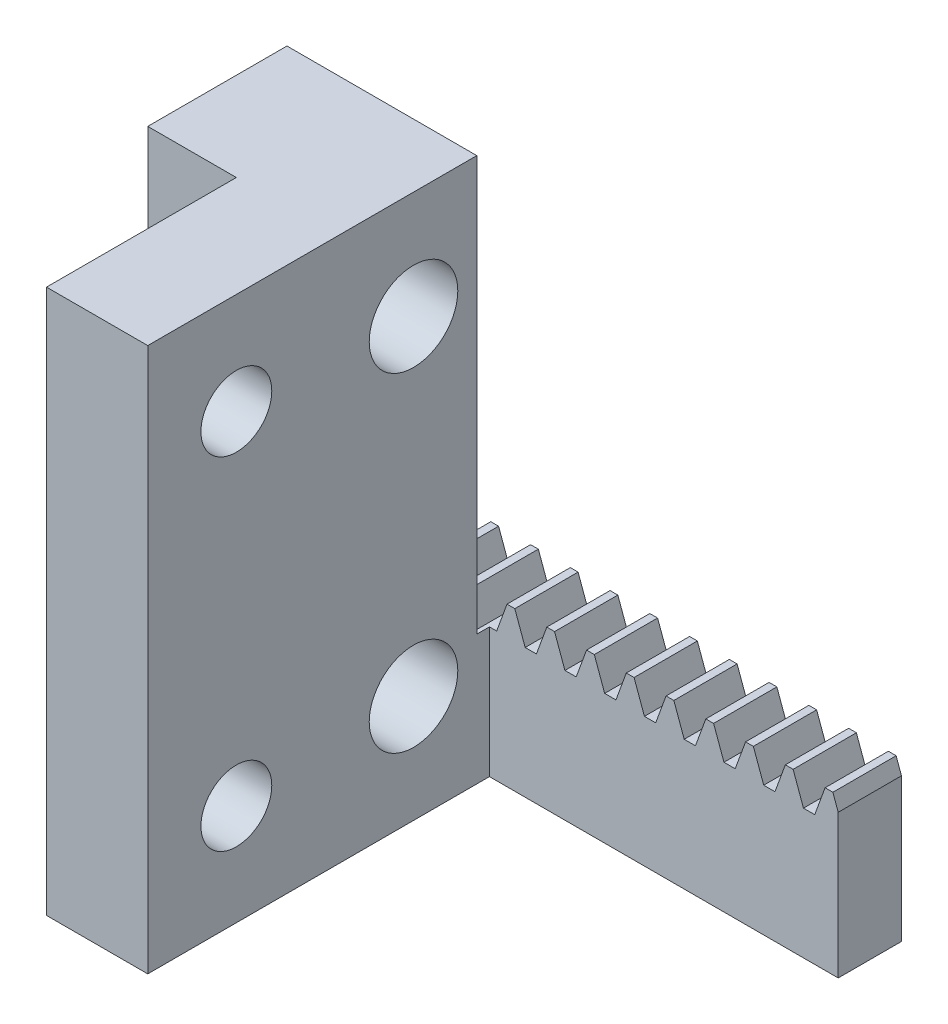
from build123d import *

# Parameters (mm, degrees)
BLANKSKE_W                 = 40
BLANKSKE_H                 = 12.5
BLANK_DEPTH                = 5
TOOTHCUTSIM_DEPTH          = 43.20485754
TEETHCUTS_COUNT            = 14
TEETHCUTS_PITCH            = 3.14159265
MOVE_FACE1_BY              = 0.44
SKETCH1_W                  = 15
SKETCH1_H                  = 43
BOSS_EXTRUDE1_DEPTH        = 12
F_7_0_7_DIAMETER_HOLE1_D   = 7
SKETCH6_W                  = 2.7
SKETCH6_H                  = 17
BOSS_EXTRUDE2_DEPTH        = 3.5
SKETCH7_W                  = 8
SKETCH7_H                  = 43
BOSS_EXTRUDE3_DEPTH        = 15
F_5_6_5_6_DIAMETER_HOLE1_D = 5.6
CUT_EXTRUDE1_START         = -17
SKETCH11_W                 = 15
SKETCH11_H                 = 3.5
CUT_EXTRUDE1_DEPTH         = 17
MOVE_FACE2_BY              = 1
MOVE_FACE3_BY              = 3


with BuildPart() as part:
    # BlankSke → Blank (new body)
    with BuildSketch(Plane.XY):
        with Locations((20, 6.25)):
            Rectangle(BLANKSKE_W, BLANKSKE_H)
    extrude(amount=-BLANK_DEPTH)

    # TooCutSkeSim → ToothCutSim (cut, through all)
    with BuildSketch(Plane.XY):
        Polygon((0.44443537, 10.25), (-0.44443537, 10.25), (-1.272613241, 12.5254), (1.272613241, 12.5254), align=None)
    toothcutsim = extrude(amount=-TOOTHCUTSIM_DEPTH, mode=Mode.SUBTRACT)

    # TeethCuts: ToothCutSim ×14
    with Locations(*[(i * TEETHCUTS_PITCH, 0, 0) for i in range(1, TEETHCUTS_COUNT)]):
        add(toothcutsim, mode=Mode.SUBTRACT)

    # Move Face1: a face moved inward by 0.44
    extrude(part.faces().sort_by_distance((0, 5.125, -2.5))[0], amount=MOVE_FACE1_BY, dir=(1, 0, 0), mode=Mode.SUBTRACT)

    # Sketch1 → Boss-Extrude1 (add)
    with BuildSketch(Plane(origin=(0, 0, 0), x_dir=(-1, 0, 0), z_dir=(0, 0, -1))):
        with Locations((-4.94, 21.5)):
            Rectangle(SKETCH1_W, SKETCH1_H)
    extrude(amount=-BOSS_EXTRUDE1_DEPTH)

    # Ø7.0 (7) Diameter Hole1 (through all)
    with Locations(Plane.ZY.offset(2.56)):
        with Locations((6, 34.5), (6, 8.5)):
            Hole(F_7_0_7_DIAMETER_HOLE1_D / 2)

    # Sketch6 → Boss-Extrude2 (add)
    with BuildSketch(Plane.XZ):
        with Locations((-1.21, 3.5)):
            Rectangle(SKETCH6_W, SKETCH6_H)
        with Locations((11.09, 3.5)):
            Rectangle(SKETCH6_W, SKETCH6_H)
    extrude(amount=BOSS_EXTRUDE2_DEPTH)

    # Sketch7 → Boss-Extrude3 (add)
    with BuildSketch(Plane.XY.offset(12)):
        with Locations((8.44, 21.5)):
            Rectangle(SKETCH7_W, SKETCH7_H)
    extrude(amount=BOSS_EXTRUDE3_DEPTH)

    # Ø5.6 (5.6) Diameter Hole1 (through all)
    with Locations(Plane(origin=(12.44, 0, 0), x_dir=(0, 0, -1), z_dir=(1, 0, 0))):
        with Locations((-20, 35), (-20, 8)):
            Hole(F_5_6_5_6_DIAMETER_HOLE1_D / 2)

    # Sketch11 → Cut-Extrude1 (cut)
    with BuildSketch(Plane.XY.offset(12).offset(CUT_EXTRUDE1_START)):
        with Locations((4.94, -1.75)):
            Rectangle(SKETCH11_W, SKETCH11_H)
    extrude(amount=CUT_EXTRUDE1_DEPTH, mode=Mode.SUBTRACT)

    # Move Face2: a face moved inward by 1.0
    extrude(part.faces().sort_by_distance((4.543546999, 25.718346506, 0))[0], amount=MOVE_FACE2_BY, dir=(0, 0, 1), mode=Mode.SUBTRACT)

    # Move Face3: a face moved outward by 3.0
    extrude(part.faces().sort_by_distance((0.44, 5.125, -2))[0], amount=MOVE_FACE3_BY, dir=(-1, 0, 0))


solid = part.part
